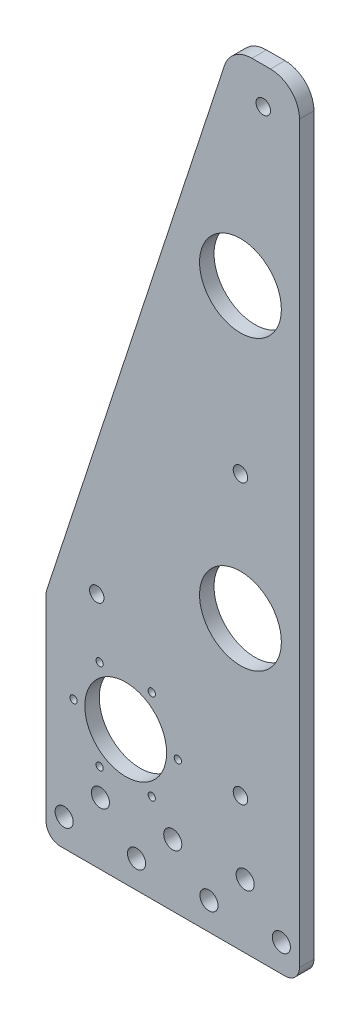
from build123d import *

# Parameters (mm, degrees)
SKETCH1_R           = 14.351
SKETCH1_R_2         = 2.54
SKETCH1_R_3         = 3.175
SKETCH1_R_4         = 1.27
BOSS_EXTRUDE1_DEPTH = 5.08
SKETCH2_R           = 2.54
BOSS_EXTRUDE2_DEPTH = 5.08
SKETCH3_R           = 2.54
CUT_EXTRUDE1_DEPTH  = 288.202574675


with BuildPart() as part:
    # Sketch1 → Boss-Extrude1 (new body)
    with BuildSketch(Plane.XY):
        with BuildLine():
            Line((88.9, 212.09), (88.9, 5.08))
            ThreePointArc((88.9, 5.08), (87.412102448, 1.487897552), (83.82, 0))
            Line((83.82, 0), (5.08, 0))
            ThreePointArc((5.08, 0), (1.487897552, 1.487897552), (0, 5.08))
            Line((0, 5.08), (0, 73.969993162))
            ThreePointArc((0, 73.969993162), (0.063384098, 74.769971217), (0.25195468, 75.549986324))
            Line((0.25195468, 75.549986324), (45.969223296, 215.249986324))
            ThreePointArc((45.969223296, 215.249986324), (49.662087504, 220.315906061), (55.625313935, 222.25))
            Line((55.625313935, 222.25), (78.74, 222.25))
            ThreePointArc((78.74, 222.25), (85.924204897, 219.274204897), (88.9, 212.09))
        make_face()
        with Locations((68.199, 201.93)):
            Circle(SKETCH1_R, mode=Mode.SUBTRACT)
        with Locations((68.199, 100.838)):
            Circle(SKETCH1_R, mode=Mode.SUBTRACT)
        with Locations((68.199, 144.78)):
            Circle(SKETCH1_R_2, mode=Mode.SUBTRACT)
        with Locations((68.199, 46.99)):
            Circle(SKETCH1_R_2, mode=Mode.SUBTRACT)
        with Locations((27.94, 46.99)):
            Circle(SKETCH1_R, mode=Mode.SUBTRACT)
        with Locations((6.35, 9.652)):
            Circle(SKETCH1_R_3, mode=Mode.SUBTRACT)
        with Locations((31.75, 9.652)):
            Circle(SKETCH1_R_3, mode=Mode.SUBTRACT)
        with Locations((57.15, 9.652)):
            Circle(SKETCH1_R_3, mode=Mode.SUBTRACT)
        with Locations((82.55, 9.652)):
            Circle(SKETCH1_R_3, mode=Mode.SUBTRACT)
        with Locations(Location((69.85, 22.352, 0), (0, 0, 180))):
            Circle(SKETCH1_R_3, mode=Mode.SUBTRACT)
        with Locations(Location((44.45, 21.844, 0), (0, 0, 180))):
            Circle(SKETCH1_R_3, mode=Mode.SUBTRACT)
        with Locations(Location((19.05, 21.844, 0), (0, 0, 180))):
            Circle(SKETCH1_R_3, mode=Mode.SUBTRACT)
        with Locations((46.228, 46.99)):
            Circle(SKETCH1_R_4, mode=Mode.SUBTRACT)
        with Locations((37.084, 31.152127416)):
            Circle(SKETCH1_R_4, mode=Mode.SUBTRACT)
        with Locations((18.796, 31.152127416)):
            Circle(SKETCH1_R_4, mode=Mode.SUBTRACT)
        with Locations((9.652, 46.99)):
            Circle(SKETCH1_R_4, mode=Mode.SUBTRACT)
        with Locations((18.796, 62.827872584)):
            Circle(SKETCH1_R_4, mode=Mode.SUBTRACT)
        with Locations((37.084, 62.827872584)):
            Circle(SKETCH1_R_4, mode=Mode.SUBTRACT)
    extrude(amount=BOSS_EXTRUDE1_DEPTH)

    # Sketch2 → Boss-Extrude2 (add)
    with BuildSketch(Plane.XY.offset(5.08)):
        with BuildLine():
            Line((45.969223296, 215.249986324), (62.593684611, 266.049986324))
            ThreePointArc((62.593684611, 266.049986324), (66.286548819, 271.115906061), (72.24977525, 273.05))
            Line((72.24977525, 273.05), (78.74, 273.05))
            ThreePointArc((78.74, 273.05), (85.924204897, 270.074204897), (88.9, 262.89))
            Line((88.9, 262.89), (88.9, 212.09))
            Line((88.9, 212.09), (78.74, 222.25))
            Line((78.74, 222.25), (55.625313935, 222.25))
            Line((55.625313935, 222.25), (45.969223296, 215.249986324))
        make_face()
        with Locations((76.2, 260.35)):
            Circle(SKETCH2_R, mode=Mode.SUBTRACT)
    extrude(amount=-BOSS_EXTRUDE2_DEPTH)

    # Sketch3 → Cut-Extrude1 (cut, through all)
    with BuildSketch(Plane.XY.offset(5.08)):
        with Locations((17.78, 83.058)):
            Circle(SKETCH3_R)
    extrude(amount=-CUT_EXTRUDE1_DEPTH, mode=Mode.SUBTRACT)


solid = part.part
